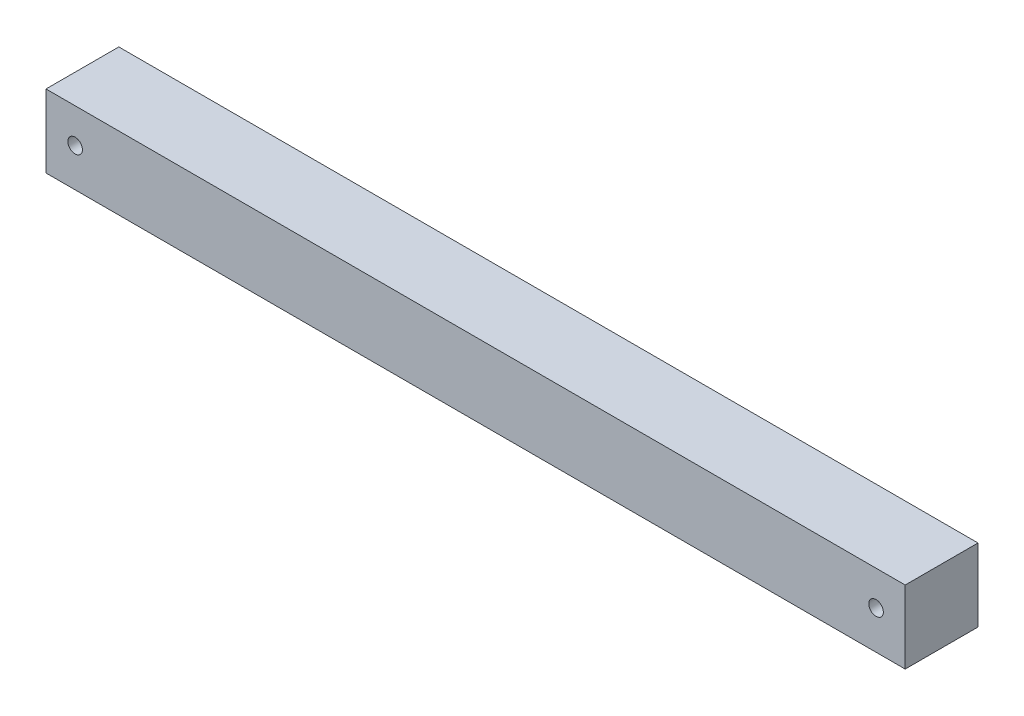
from build123d import *

# Parameters (mm, degrees)
ESQUISSE1_W        = 118
ESQUISSE1_H        = 10
ESQUISSE1_R        = 1
BOSS_EXTRU_1_DEPTH = 10


with BuildPart() as part:
    # Esquisse1 → Boss.-Extru.1 (new body)
    with BuildSketch(Plane.XY):
        with Locations((39.941925861, 16.285915493)):
            Rectangle(ESQUISSE1_W, ESQUISSE1_H)
        with Locations((94.941925861, 16.553552035)):
            Circle(ESQUISSE1_R, mode=Mode.SUBTRACT)
        with Locations((-15.058074139, 16.553552035)):
            Circle(ESQUISSE1_R, mode=Mode.SUBTRACT)
    extrude(amount=BOSS_EXTRU_1_DEPTH)


solid = part.part
